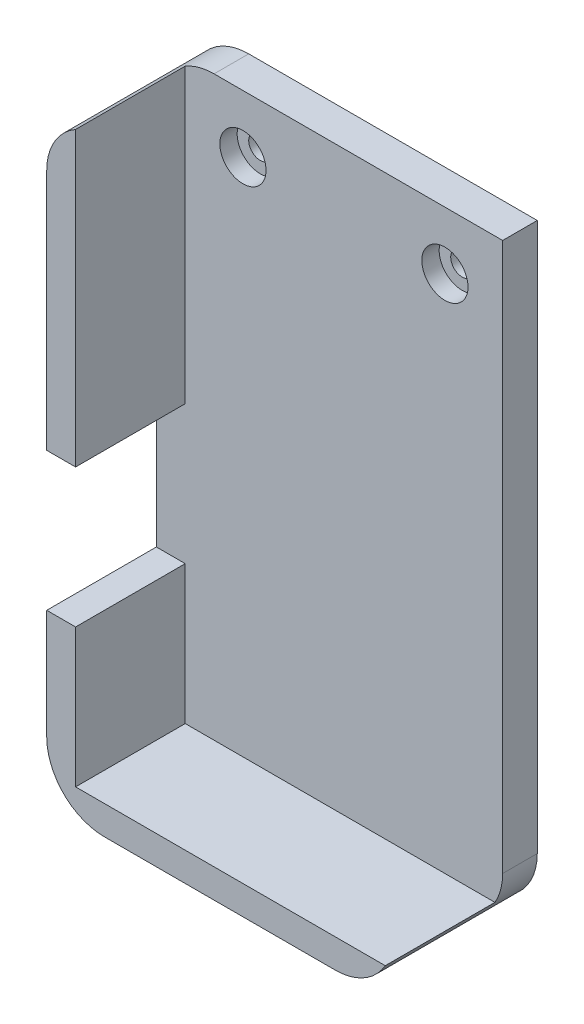
from build123d import *

# Parameters (mm, degrees)
SKETCH1_W           = 60
SKETCH1_H           = 105
BOSS_EXTRUDE4_DEPTH = 6
BOSS_EXTRUDE5_DEPTH = 25
SKETCH1_15_R        = 2
CUT_EXTRUDE1_DEPTH  = 25
SKETCH1_16_R        = 4
SKETCH1_16_R_2      = 2
CUT_EXTRUDE2_DEPTH  = 25
SKETCH1_18_R        = 4
SKETCH1_18_R_2      = 2
BOSS_EXTRUDE7_DEPTH = 3
FILLET1_R           = 10
SKETCH2_W           = 5
SKETCH2_H           = 24
CUT_EXTRUDE3_DEPTH  = 19


with BuildPart() as part:
    # Sketch1 → Boss-Extrude4 (new body)
    with BuildSketch(Plane.XY):
        with Locations((30, 52.5)):
            Rectangle(SKETCH1_W, SKETCH1_H)
    extrude(amount=BOSS_EXTRUDE4_DEPTH)

    # Sketch1<12> → Boss-Extrude5 (add)
    with BuildSketch(Plane.XY):
        Polygon((5, 5), (5, 105), (0, 105), (0, 0), (60, 0), (60, 5), align=None)
    extrude(amount=BOSS_EXTRUDE5_DEPTH)

    # Sketch1<15> → Cut-Extrude1 (cut)
    with BuildSketch(Plane.XY):
        with Locations((50, 95)):
            Circle(SKETCH1_15_R)
        with Locations((15, 95)):
            Circle(SKETCH1_15_R)
    extrude(amount=CUT_EXTRUDE1_DEPTH, mode=Mode.SUBTRACT)

    # Sketch1<16> → Cut-Extrude2 (cut)
    # profile 1 of 2: a face of its own
    with BuildSketch(Plane.XY):
        with Locations((15, 95)):
            Circle(SKETCH1_16_R)
        with Locations((15, 95)):
            Circle(SKETCH1_16_R_2, mode=Mode.SUBTRACT)
    # profile 2 of 2: a face of its own
    with BuildSketch(Plane.XY):
        with Locations((50, 95)):
            Circle(SKETCH1_16_R)
        with Locations((50, 95)):
            Circle(SKETCH1_16_R_2, mode=Mode.SUBTRACT)
    extrude(amount=CUT_EXTRUDE2_DEPTH, mode=Mode.SUBTRACT)

    # Sketch1<18> → Boss-Extrude7 (add)
    # profile 1 of 2: a face of its own
    with BuildSketch(Plane.XY):
        with Locations((15, 95)):
            Circle(SKETCH1_18_R)
        with Locations((15, 95)):
            Circle(SKETCH1_18_R_2, mode=Mode.SUBTRACT)
    # profile 2 of 2: a face of its own
    with BuildSketch(Plane.XY):
        with Locations((50, 95)):
            Circle(SKETCH1_18_R)
        with Locations((50, 95)):
            Circle(SKETCH1_18_R_2, mode=Mode.SUBTRACT)
    extrude(amount=BOSS_EXTRUDE7_DEPTH)

    # Fillet1
    fillet1_edges = [part.edges().sort_by_distance(p)[0] for p in [
        (60, 0, 12.5),
        (0, 105, 12.5),
        (0, 0, 12.5),
    ]]
    fillet(fillet1_edges, radius=FILLET1_R)

    # Sketch2 → Cut-Extrude3 (cut)
    with BuildSketch(Plane.XY.offset(25)):
        with Locations((2.5, 41)):
            Rectangle(SKETCH2_W, SKETCH2_H)
    extrude(amount=-CUT_EXTRUDE3_DEPTH, mode=Mode.SUBTRACT)


solid = part.part
